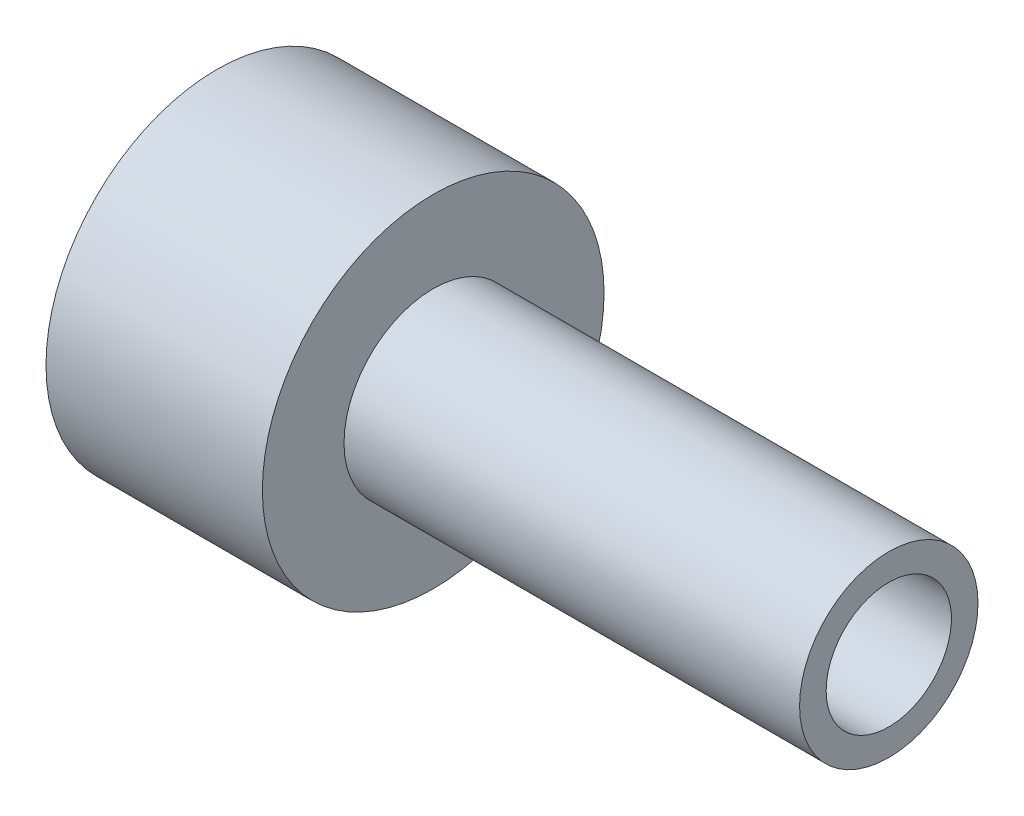
from build123d import *


with BuildPart() as part:
    # Axial profile (mm) → Full revolution (revolve)
    with BuildSketch(Plane.XY, mode=Mode.PRIVATE) as full_revolution_sk:
        Polygon((8, 1.65), (25.7, 1.65), (25.7, 2.35), (13.7, 2.35), (13.7, 4.5), (8, 4.5), align=None)
    revolve(full_revolution_sk.sketch.rotate(Axis((-110, 0, 0), (1, 0, 0)), 90), axis=Axis((-110, 0, 0), (1, 0, 0)))


solid = part.part
